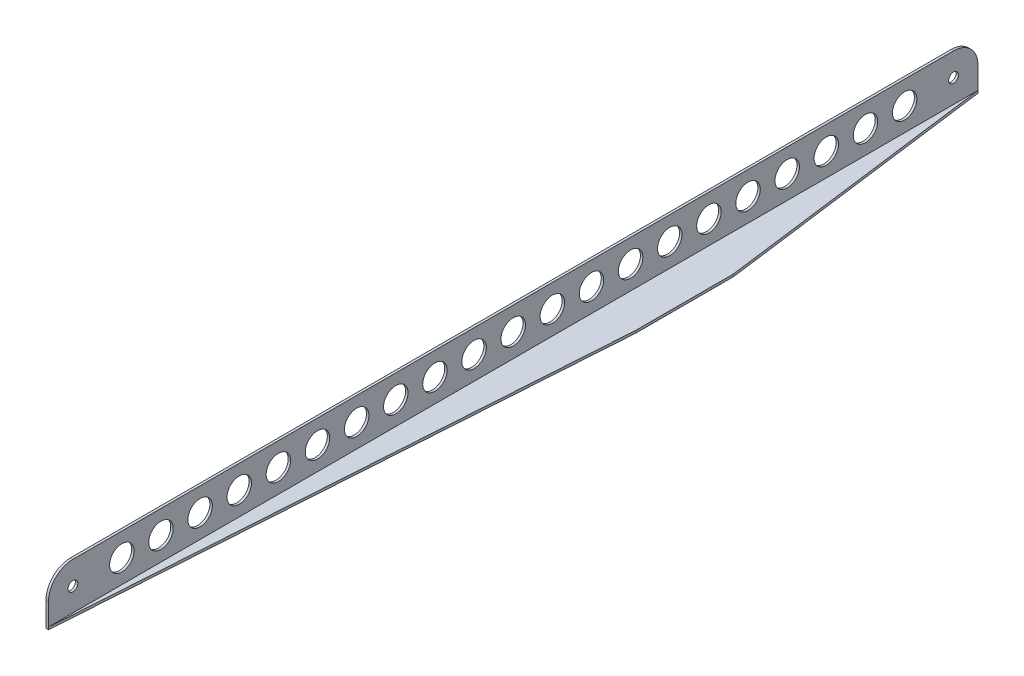
from build123d import *

# Parameters (mm, degrees)
BOSS_EXTRUDE1_DEPTH = 380
SKETCH2_R           = 2
CUT_EXTRUDE1_DEPTH  = 10
CUT_EXTRUDE2_DEPTH  = 10
SKETCH5_R           = 5
CUT_EXTRUDE3_DEPTH  = 10
LPATTERN1_COUNT     = 21
LPATTERN1_PITCH     = 16
FILLET1_R           = 10


with BuildPart() as part:
    # Sketch1 → Boss-Extrude1 (new body)
    with BuildSketch(Plane.XY):
        Polygon((0, -15.388010819), (0, -35.388010819), (20, -35.388010819), (20, -34.388010819), (1, -34.388010819), (1, -15.388010819), align=None)
    extrude(amount=BOSS_EXTRUDE1_DEPTH)

    # Sketch2 → Cut-Extrude1 (cut)
    with BuildSketch(Plane(origin=(1, 0, 0), x_dir=(0, 0, -1), z_dir=(1, 0, 0))):
        with Locations(Location((-10, -24.888010819, 0), (0, 0, 90))):
            Circle(SKETCH2_R)
        with Locations(Location((-370, -24.888010819, 0), (0, 0, 90))):
            Circle(SKETCH2_R)
    extrude(amount=-CUT_EXTRUDE1_DEPTH, mode=Mode.SUBTRACT)

    # Sketch4 → Cut-Extrude2 (cut)
    with BuildSketch(Plane(origin=(0, -34.388010819, 0), x_dir=(1, 0, 0), z_dir=(0, 1, 0))):
        Polygon((1, 0), (16, -115), (16, -155), (1, -380), (1, -389.212459491), (24.909334079, -389.212459491), (24.909334079, 2.402258562), (1, 2.402258562), align=None)
    extrude(amount=-CUT_EXTRUDE2_DEPTH, mode=Mode.SUBTRACT)

    # Sketch5 → Cut-Extrude3 (cut)
    with BuildSketch(Plane(origin=(1, 0, 0), x_dir=(0, 0, -1), z_dir=(1, 0, 0))):
        with Locations(Location((-350, -24.888010819, 0), (0, 0, 90))):
            Circle(SKETCH5_R)
    cut_extrude3 = extrude(amount=-CUT_EXTRUDE3_DEPTH, mode=Mode.SUBTRACT)

    # LPattern1: Cut-Extrude3 ×21
    with Locations(*[(0, 0, -i * LPATTERN1_PITCH) for i in range(1, LPATTERN1_COUNT)]):
        add(cut_extrude3, mode=Mode.SUBTRACT)

    # Fillet1
    fillet1_edges = [part.edges().sort_by_distance(p)[0] for p in [
        (0.5, -15.388010819, 380),
        (0.5, -15.388010819, 0),
    ]]
    fillet(fillet1_edges, radius=FILLET1_R)


solid = part.part
